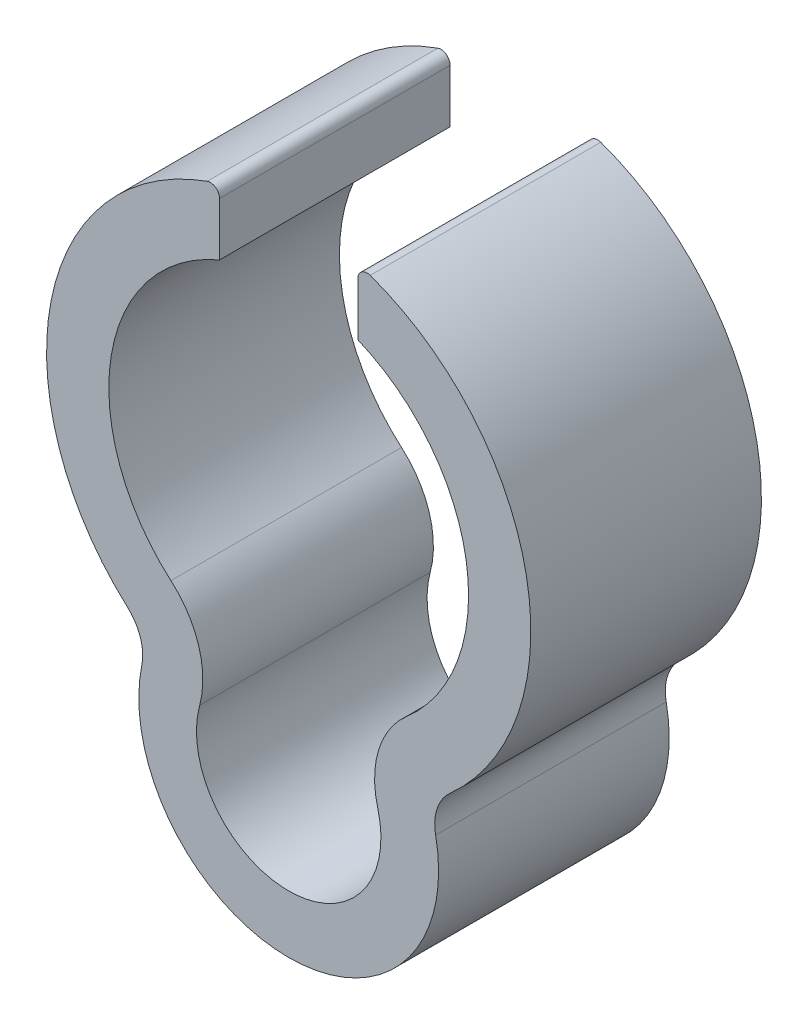
from build123d import *

# Parameters (mm, degrees)
P_IDAT_VYSUNUT_M1_DEPTH = 5
ZAOBLIT1_R              = 0.2


with BuildPart() as part:
    # Skica1 → Přidat vysunutím1 (new body)
    with BuildSketch(Plane.XY):
        with BuildLine():
            ThreePointArc((-1.931217233, -4.98), (0, -7.5), (1.931217233, -4.98))
            ThreePointArc((1.931217233, -4.98), (1.950012982, -3.874641932), (2.553134647, -2.948135593))
            ThreePointArc((2.553134647, -2.948135593), (3.850518803, 0.619277763), (1.5, 3.6))
            Line((1.5, 3.6), (1.5, 5.031152949))
            ThreePointArc((1.5, 5.031152949), (5.123560056, 1.145265189), (3.49942144, -3.913636364))
            ThreePointArc((3.49942144, -3.913636364), (3.217064036, -4.343555698), (3.185747809, -4.856951872))
            ThreePointArc((3.185747809, -4.856951872), (0, -8.75), (-3.185747809, -4.856951872))
            ThreePointArc((-3.185747809, -4.856951872), (-3.217064036, -4.343555698), (-3.49942144, -3.913636364))
            ThreePointArc((-3.49942144, -3.913636364), (-5.123560056, 1.145265189), (-1.5, 5.031152949))
            Line((-1.5, 5.031152949), (-1.5, 3.6))
            ThreePointArc((-1.5, 3.6), (-3.850518803, 0.619277763), (-2.553134647, -2.948135593))
            ThreePointArc((-2.553134647, -2.948135593), (-1.950012982, -3.874641932), (-1.931217233, -4.98))
        make_face()
    extrude(amount=P_IDAT_VYSUNUT_M1_DEPTH)

    # Zaoblit1
    zaoblit1_edges = [part.edges().sort_by_distance(p)[0] for p in [
        (1.5, 5.031152949, 2.5),
        (-1.5, 5.031152949, 2.5),
    ]]
    fillet(zaoblit1_edges, radius=ZAOBLIT1_R)


solid = part.part
